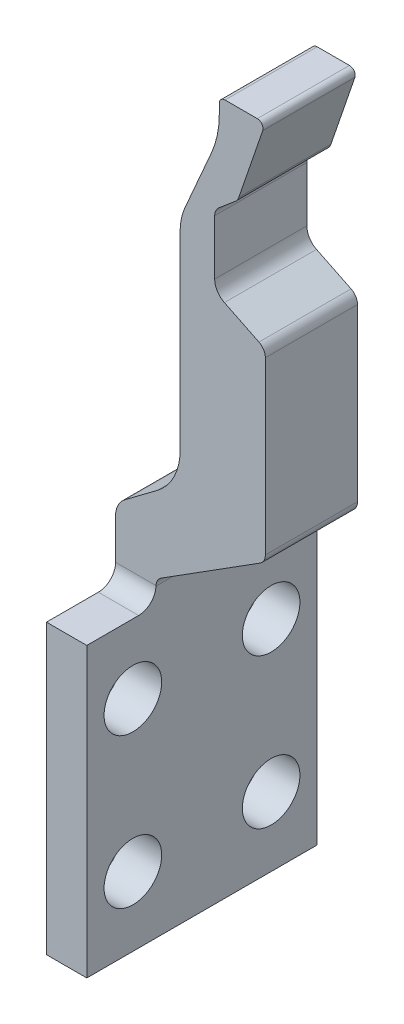
from build123d import *

# Parameters (mm, degrees)
SKETCH1_W                = 20
SKETCH1_H                = 25
BOSS_EXTRUDE2_DEPTH      = 3.5
BOSS_EXTRUDE3_DEPTH      = 9.5
BOSS_EXTRUDE3_DEPTH_BACK = 3.5
SKETCH2_W                = 8
SKETCH2_H                = 41
SKETCH3_R                = 2.5
CUT_EXTRUDE1_DEPTH       = 9.5
CUT_EXTRUDE2_DEPTH       = 9.5
FILLET1_R                = 1.5
FILLET2_R                = 1.5
FILLET3_R                = 2
FILLET4_R                = 5
FILLET5_R                = 5
FILLET6_R                = 8
FILLET7_R                = 0.5
FILLET8_R                = 1
FILLET9_R                = 1
FILLET10_R               = 1
FILLET11_R               = 1.5
FILLET12_R               = 1
FILLET13_R               = 1
FILLET14_R               = 0.5


with BuildPart() as part:
    # Sketch1 → Boss-Extrude2 (new body)
    with BuildSketch(Plane(origin=(0, 0, 0), x_dir=(0, 0, -1), z_dir=(1, 0, 0))):
        with Locations((10, 12.5)):
            Rectangle(SKETCH1_W, SKETCH1_H)
    extrude(amount=BOSS_EXTRUDE2_DEPTH)

    # Sketch2 → Boss-Extrude3 (add, two sides: drawn at the far end of the back side and taken through both)
    with BuildSketch(Plane(origin=(3.5, 0, 0), x_dir=(0, 0, -1), z_dir=(1, 0, 0)).offset(-BOSS_EXTRUDE3_DEPTH_BACK)):
        with Locations((10, 45.5)):
            Rectangle(SKETCH2_W, SKETCH2_H)
    extrude(amount=BOSS_EXTRUDE3_DEPTH + BOSS_EXTRUDE3_DEPTH_BACK)

    # Sketch3 → Cut-Extrude1 (cut)
    with BuildSketch(Plane.ZY):
        with Locations((-16, 19)):
            Circle(SKETCH3_R)
        with Locations((-16, 6)):
            Circle(SKETCH3_R)
        with Locations((-4, 6)):
            Circle(SKETCH3_R)
        with Locations((-4, 19)):
            Circle(SKETCH3_R)
    extrude(amount=-CUT_EXTRUDE1_DEPTH, mode=Mode.SUBTRACT)

    # Sketch4 → Cut-Extrude2 (cut)
    with BuildSketch(Plane.XY.offset(-6)):
        Polygon((0, 66), (0, 31), (5.600462456, 35.199383322), (5.600462456, 55.199383322), (9, 63), (9, 66), align=None)
        Polygon((3.5, 27), (3.5, 25), (13, 25), (13, 33), align=None)
        Polygon((13, 49), (13, 66), (10.600462456, 59.00909695), (8.600462456, 57.318186777), (8.600462456, 51.153091521), align=None)
    extrude(amount=-CUT_EXTRUDE2_DEPTH, mode=Mode.SUBTRACT)

    # Fillet1
    fillet1_edges = [part.edges().sort_by_distance(p)[0] for p in [
        (1.75, 25, -6),
    ]]
    fillet(fillet1_edges, radius=FILLET1_R)

    # Fillet2
    fillet2_edges = [part.edges().sort_by_distance(p)[0] for p in [
        (1.75, 25, -14),
    ]]
    fillet(fillet2_edges, radius=FILLET2_R)

    # Fillet3
    fillet3_edges = [part.edges().sort_by_distance(p)[0] for p in [
        (0, 31, -10),
    ]]
    fillet(fillet3_edges, radius=FILLET3_R)

    # Fillet4
    fillet4_edges = [part.edges().sort_by_distance(p)[0] for p in [
        (5.600462456, 35.199383322, -10),
    ]]
    fillet(fillet4_edges, radius=FILLET4_R)

    # Fillet5
    fillet5_edges = [part.edges().sort_by_distance(p)[0] for p in [
        (5.600462456, 55.199383322, -10),
    ]]
    fillet(fillet5_edges, radius=FILLET5_R)

    # Fillet6
    fillet6_edges = [part.edges().sort_by_distance(p)[0] for p in [
        (9, 63, -10),
    ]]
    fillet(fillet6_edges, radius=FILLET6_R)

    # Fillet7
    fillet7_edges = [part.edges().sort_by_distance(p)[0] for p in [
        (9, 66, -10),
    ]]
    fillet(fillet7_edges, radius=FILLET7_R)

    # Fillet8
    fillet8_edges = [part.edges().sort_by_distance(p)[0] for p in [
        (3.5, 27, -10),
    ]]
    fillet(fillet8_edges, radius=FILLET8_R)

    # Fillet9
    fillet9_edges = [part.edges().sort_by_distance(p)[0] for p in [
        (13, 33, -10),
    ]]
    fillet(fillet9_edges, radius=FILLET9_R)

    # Fillet10
    fillet10_edges = [part.edges().sort_by_distance(p)[0] for p in [
        (13, 49, -10),
    ]]
    fillet(fillet10_edges, radius=FILLET10_R)

    # Fillet11
    fillet11_edges = [part.edges().sort_by_distance(p)[0] for p in [
        (8.600462456, 51.153091521, -10),
    ]]
    fillet(fillet11_edges, radius=FILLET11_R)

    # Fillet12
    fillet12_edges = [part.edges().sort_by_distance(p)[0] for p in [
        (8.600462456, 57.318186777, -10),
    ]]
    fillet(fillet12_edges, radius=FILLET12_R)

    # Fillet13
    fillet13_edges = [part.edges().sort_by_distance(p)[0] for p in [
        (10.600462456, 59.00909695, -10),
    ]]
    fillet(fillet13_edges, radius=FILLET13_R)

    # Fillet14
    fillet14_edges = [part.edges().sort_by_distance(p)[0] for p in [
        (13, 66, -10),
    ]]
    fillet(fillet14_edges, radius=FILLET14_R)


solid = part.part
